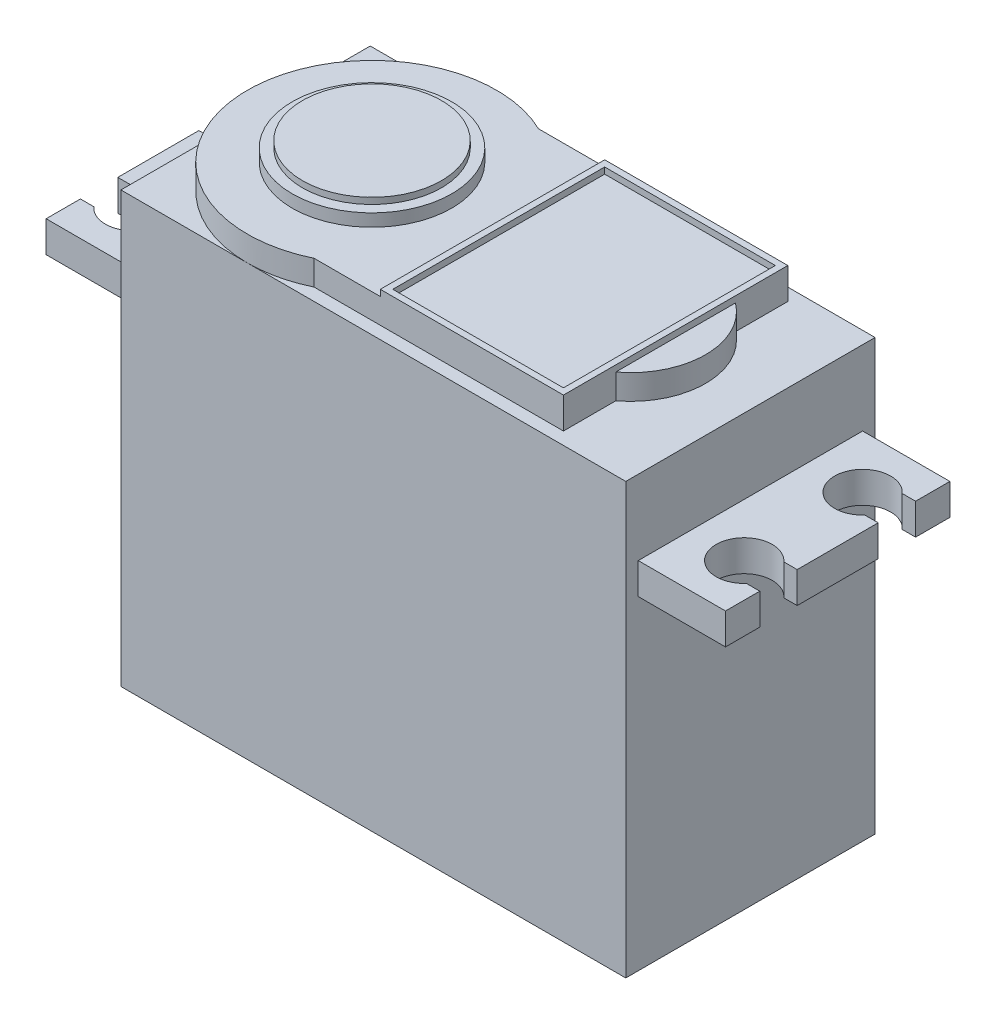
from build123d import *

# Parameters (mm, degrees)
SKETCH1_W            = 40.5
SKETCH1_H            = 20
BOSS_EXTRUDE1_DEPTH  = 35.5
BOSS_EXTRUDE2_DEPTH  = 2
SKETCH3_R            = 6.4
BOSS_EXTRUDE3_DEPTH  = 1
SKETCH4_R            = 5.575
BOSS_EXTRUDE4_DEPTH  = 0.5
BOSS_EXTRUDE5_DEPTH  = 2.5
MIRROR2_COPY_1_DEPTH = 2.5
CHAMFER1_SIZE        = 1
SKETCH6_W            = 3
SKETCH6_H            = 1
BOSS_EXTRUDE6_DEPTH  = 6
DRAFT1_ANGLE         = 10
SKETCH7_W            = 14.691761142
SKETCH7_H            = 18
SKETCH7_W_2          = 13.691761142
SKETCH7_H_2          = 17
BOSS_EXTRUDE7_DEPTH  = 0.5


with BuildPart() as part:
    # Sketch1 → Boss-Extrude1 (new body)
    with BuildSketch(Plane(origin=(0, 0, 0), x_dir=(1, 0, 0), z_dir=(0, 1, 0))):
        Rectangle(SKETCH1_W, SKETCH1_H)
    extrude(amount=BOSS_EXTRUDE1_DEPTH)

    # Sketch2 → Boss-Extrude2 (add)
    with BuildSketch(Plane(origin=(0, 35.5, 0), x_dir=(1, 0, 0), z_dir=(0, 1, 0))):
        with BuildLine():
            Line((-5.75, -9), (14.25, -9))
            Line((14.25, -9), (14.25, -4.8))
            ThreePointArc((14.25, -4.8), (16.65, 0), (14.25, 4.8))
            Line((14.25, 4.8), (14.25, 9))
            Line((14.25, 9), (-5.75, 9))
            ThreePointArc((-5.75, 9), (-20.108898944, 0), (-5.75, -9))
        make_face()
    extrude(amount=BOSS_EXTRUDE2_DEPTH)

    # Sketch3 → Boss-Extrude3 (add)
    with BuildSketch(Plane(origin=(0, 37.5, 0), x_dir=(1, 0, 0), z_dir=(0, 1, 0))):
        with Locations(Location((-10.108898944, 0, 0), (0, 0, 270))):
            Circle(SKETCH3_R)
    extrude(amount=BOSS_EXTRUDE3_DEPTH)

    # Sketch4 → Boss-Extrude4 (add)
    with BuildSketch(Plane(origin=(0, 38.5, 0), x_dir=(1, 0, 0), z_dir=(0, 1, 0))):
        with Locations(Location((-10.108898944, 0, 0), (0, 0, 270))):
            Circle(SKETCH4_R)
    extrude(amount=BOSS_EXTRUDE4_DEPTH)

    # Sketch5 → Boss-Extrude5 (add)
    with BuildSketch(Plane(origin=(0, 29.5, 0), x_dir=(1, 0, 0), z_dir=(0, 1, 0))):
        with BuildLine():
            Line((20.25, 9), (27.25, 9))
            Line((27.25, 9), (27.25, 6.25))
            Line((27.25, 6.25), (26.177050983, 6.25))
            ThreePointArc((26.177050983, 6.25), (22.25, 4.75), (26.177050983, 3.25))
            Line((26.177050983, 3.25), (27.25, 3.25))
            Line((27.25, 3.25), (27.25, 0))
            Line((27.25, 0), (20.25, 0))
            Line((20.25, 0), (20.25, 9))
        make_face()
    boss_extrude5 = extrude(amount=-BOSS_EXTRUDE5_DEPTH)

    # Mirror1: Boss-Extrude5 across plane
    add(boss_extrude5.mirror(Plane(origin=(0, 0, 0), x_dir=(0, 0, 1), z_dir=(1, 0, 0))))

    # Mirror2: Boss-Extrude5 across plane
    add(boss_extrude5.mirror(Plane.XY))

    # Mirror2 copy 1 sketch → Mirror2 copy 1 (add)
    with BuildSketch(Plane(origin=(0, 29.5, 0), x_dir=(-1, 0, 0), z_dir=(0, 1, 0))):
        with BuildLine():
            Line((20.25, 9), (27.25, 9))
            Line((27.25, 9), (27.25, 6.25))
            Line((27.25, 6.25), (26.177050983, 6.25))
            ThreePointArc((26.177050983, 6.25), (22.25, 4.75), (26.177050983, 3.25))
            Line((26.177050983, 3.25), (27.25, 3.25))
            Line((27.25, 3.25), (27.25, 0))
            Line((27.25, 0), (20.25, 0))
            Line((20.25, 0), (20.25, 9))
        make_face()
    extrude(amount=-MIRROR2_COPY_1_DEPTH)

    # Chamfer1
    chamfer1_edges = [part.edges().sort_by_distance(p)[0] for p in [
        (0, 0, -10),
        (20.25, 0, 0),
        (0, 0, 10),
        (-20.25, 0, 0),
    ]]
    chamfer(chamfer1_edges, length=CHAMFER1_SIZE)

    # Sketch6 → Boss-Extrude6 (add)
    with BuildSketch(Plane.ZY.offset(20.25)):
        with Locations((0, 3)):
            Rectangle(SKETCH6_W, SKETCH6_H)
    extrude(amount=BOSS_EXTRUDE6_DEPTH)

    # Draft1
    draft1_faces = [part.faces().sort_by_distance(p)[0] for p in [
        (-23.25, 3, -1.5),
        (-23.25, 3.5, 0),
        (-23.25, 3, 1.5),
        (-23.25, 2.5, 0),
    ]]
    draft(draft1_faces, Plane(origin=(-26.25, 0, 0), x_dir=(0, 0, -1), z_dir=(-1, 0, 0)), DRAFT1_ANGLE)

    # Sketch7 → Boss-Extrude7 (add)
    with BuildSketch(Plane(origin=(0, 37.5, 0), x_dir=(1, 0, 0), z_dir=(0, 1, 0))):
        with Locations((6.904119429, 0)):
            Rectangle(SKETCH7_W, SKETCH7_H)
        with Locations((6.904119429, 0)):
            Rectangle(SKETCH7_W_2, SKETCH7_H_2, mode=Mode.SUBTRACT)
    extrude(amount=BOSS_EXTRUDE7_DEPTH)


solid = part.part
